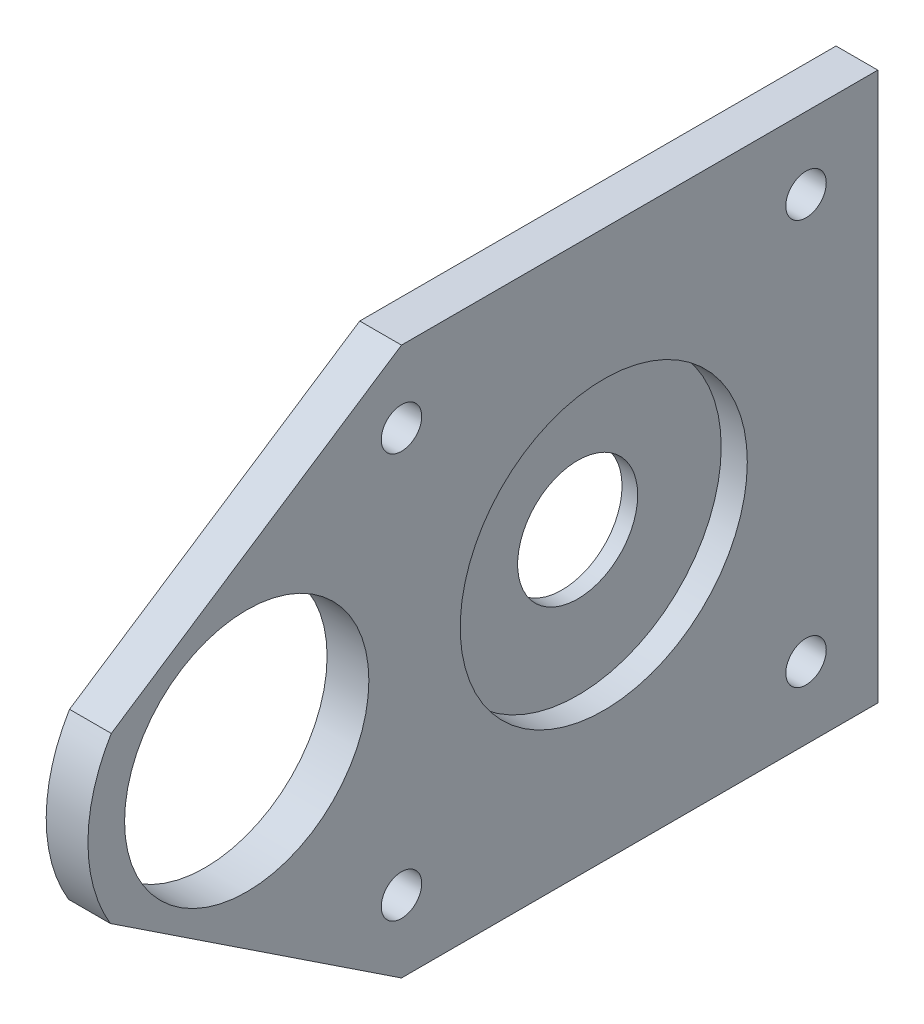
from build123d import *

# Parameters (mm, degrees)
SKETCH1_W               = 3.2
SKETCH1_H               = 42
EXTRUDE1_DEPTH          = 75
CUT_EXTRUDE1_DEPTH      = 78.900962767
CUT_EXTRUDE1_DEPTH_BACK = 78.900962767
SKETCH2_R               = 1.55
SKETCH2_R_2             = 9.36
SKETCH2_R_3             = 4.6
SKETCH3_R               = 11
CUT_EXTRUDE2_DEPTH      = 2


with BuildPart() as part:
    # Sketch1 → Extrude1 (new body)
    with BuildSketch(Plane.XY):
        Rectangle(SKETCH1_W, SKETCH1_H)
    extrude(amount=EXTRUDE1_DEPTH)

    # Sketch2 → Cut-Extrude1 (cut, two sides: drawn at the far end of the back side and taken through both)
    with BuildSketch(Plane(origin=(0, 0, 0), x_dir=(0, 0, -1), z_dir=(1, 0, 0)).offset(-CUT_EXTRUDE1_DEPTH_BACK)):
        with Locations((-5.5, 15.5)):
            Circle(SKETCH2_R)
        with Locations((-5.5, -15.5)):
            Circle(SKETCH2_R)
        with Locations((-36.5, 15.5)):
            Circle(SKETCH2_R)
        with Locations((-36.5, -15.5)):
            Circle(SKETCH2_R)
        with Locations((-48.36, 0)):
            Circle(SKETCH2_R_2)
        with Locations((-21, 0)):
            Circle(SKETCH2_R_3)
        with BuildLine():
            Line((-36.5, 21), (-58.7375, 6.35))
            ThreePointArc((-58.7375, 6.35), (-60.525927164, 0.072266755), (-58.812204228, -6.226269591))
            Line((-58.812204228, -6.226269591), (-36.5, -21))
            Line((-36.5, -21), (-75, -21))
            Line((-75, -21), (-75, 21))
            Line((-75, 21), (-36.5, 21))
        make_face()
    extrude(amount=CUT_EXTRUDE1_DEPTH + CUT_EXTRUDE1_DEPTH_BACK, mode=Mode.SUBTRACT)

    # Sketch3 → Cut-Extrude2 (cut)
    with BuildSketch(Plane(origin=(1.6, 0, 0), x_dir=(0, 0, -1), z_dir=(1, 0, 0))):
        with Locations((-21, 0)):
            Circle(SKETCH3_R)
    extrude(amount=-CUT_EXTRUDE2_DEPTH, mode=Mode.SUBTRACT)


solid = part.part
